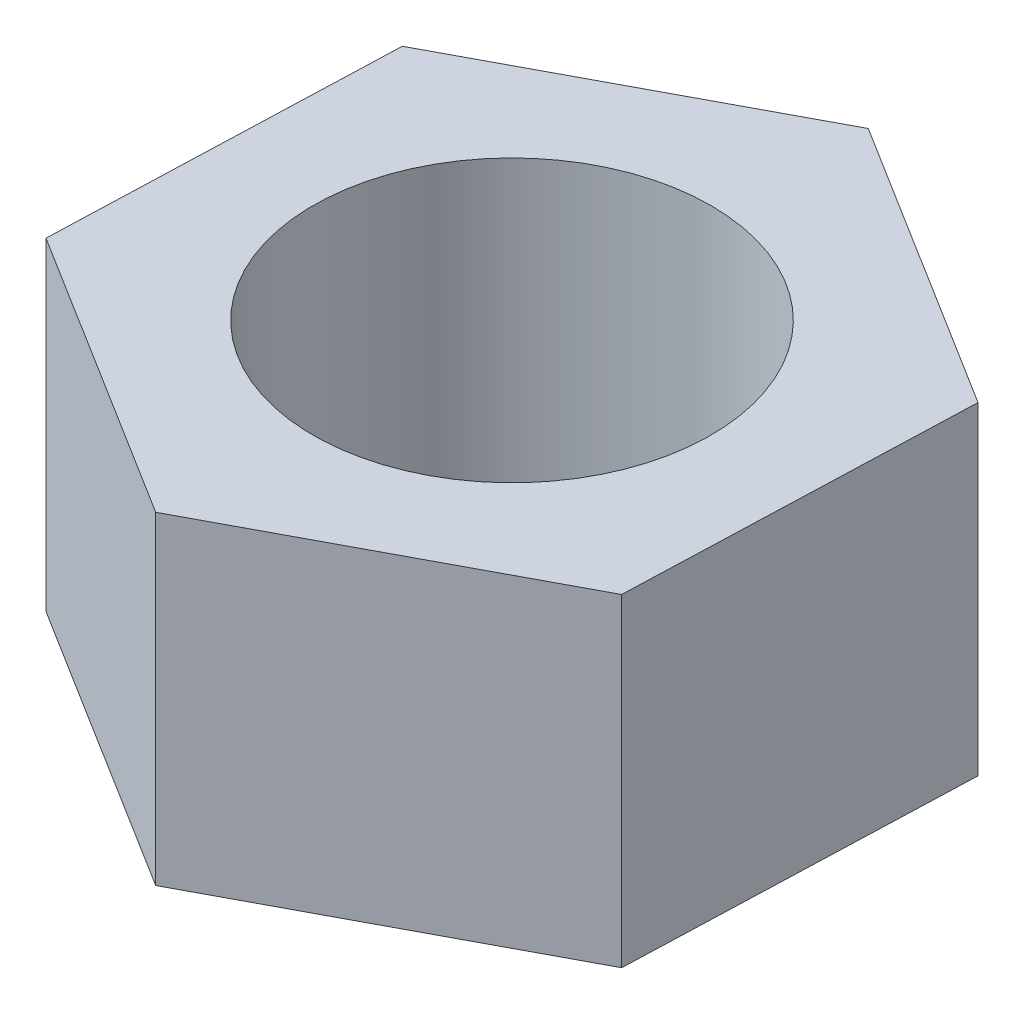
from build123d import *

# Parameters (mm, degrees)
SKETCH1_R           = 8
BOSS_EXTRUDE1_DEPTH = 13


with BuildPart() as part:
    # Sketch1 → Boss-Extrude1 (new body)
    with BuildSketch(Plane(origin=(0, 0, 0), x_dir=(1, 0, 0), z_dir=(0, 1, 0))):
        Polygon((12.233619744, 6.506807817), (0.481749005, 13.848029387), (-11.751870739, 7.34122157), (-12.233619744, -6.506807817), (-0.481749005, -13.848029387), (11.751870739, -7.34122157), align=None)
        with Locations(Location((0, 0, 0), (0, 0, 90))):
            Circle(SKETCH1_R, mode=Mode.SUBTRACT)
    extrude(amount=BOSS_EXTRUDE1_DEPTH)


solid = part.part
